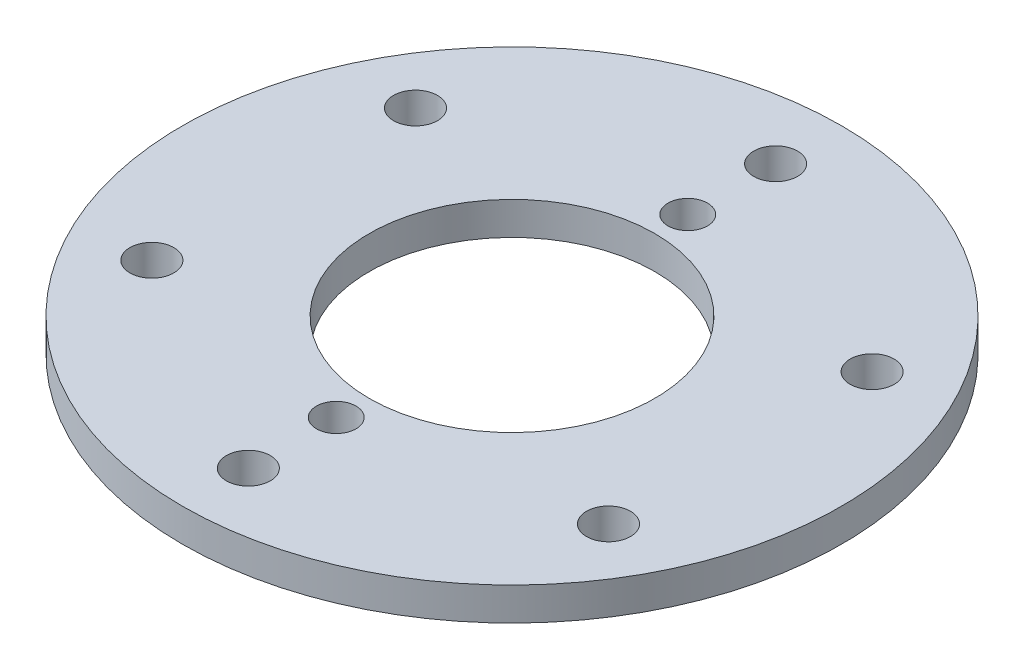
from build123d import *

# Parameters (mm, degrees)
SKETCH2_R           = 150
SKETCH2_R_2         = 65
SKETCH2_R_3         = 10
SKETCH2_R_4         = 9
BOSS_EXTRUDE1_DEPTH = 15


with BuildPart() as part:
    # Sketch2 → Boss-Extrude1 (new body)
    with BuildSketch(Plane(origin=(0, 0, 0), x_dir=(1, 0, 0), z_dir=(0, 1, 0))):
        with Locations(Location((0, 0, 0), (0, 0, 270))):
            Circle(SKETCH2_R)
        with Locations(Location((0, 0, 0), (0, 0, 270))):
            Circle(SKETCH2_R_2, mode=Mode.SUBTRACT)
        with Locations(Location((0, 120, 0), (0, 0, 270))):
            Circle(SKETCH2_R_3, mode=Mode.SUBTRACT)
        with Locations(Location((103.923048454, 60, 0), (0, 0, 270))):
            Circle(SKETCH2_R_3, mode=Mode.SUBTRACT)
        with Locations(Location((103.923048454, -60, 0), (0, 0, 270))):
            Circle(SKETCH2_R_3, mode=Mode.SUBTRACT)
        with Locations(Location((0, -120, 0), (0, 0, 270))):
            Circle(SKETCH2_R_3, mode=Mode.SUBTRACT)
        with Locations(Location((-103.923048454, -60, 0), (0, 0, 270))):
            Circle(SKETCH2_R_3, mode=Mode.SUBTRACT)
        with Locations(Location((-103.923048454, 60, 0), (0, 0, 270))):
            Circle(SKETCH2_R_3, mode=Mode.SUBTRACT)
        with Locations(Location((0, 80, 0), (0, 0, 270))):
            Circle(SKETCH2_R_4, mode=Mode.SUBTRACT)
        with Locations(Location((0, -80, 0), (0, 0, 90))):
            Circle(SKETCH2_R_4, mode=Mode.SUBTRACT)
    extrude(amount=BOSS_EXTRUDE1_DEPTH)


solid = part.part
